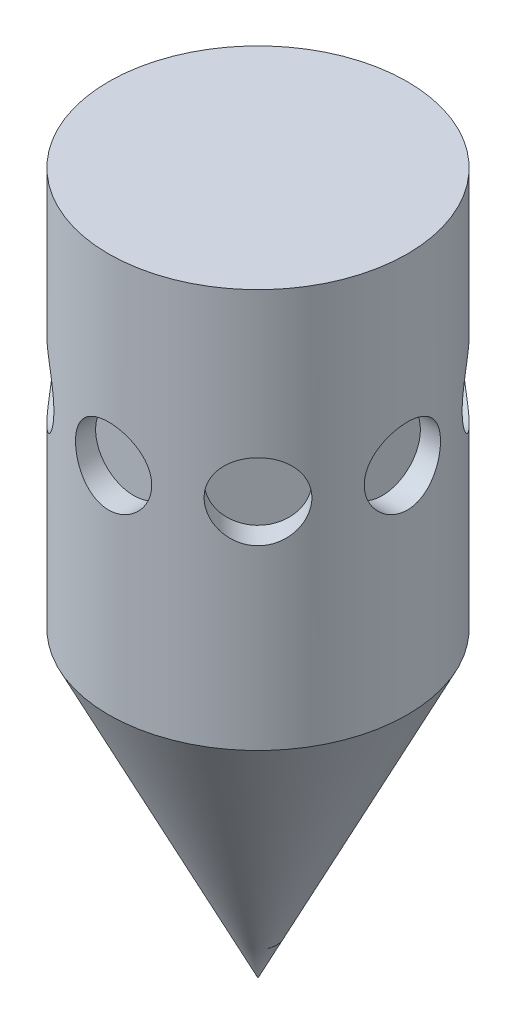
from build123d import *

# Parameters (mm, degrees)
SKETCH2_R          = 7.615394345
CUT_EXTRUDE1_DEPTH = 5
CIRPATTERN1_COUNT  = 8


with BuildPart() as part:
    # Sketch1 → Revolve1 (revolve)
    with BuildSketch(Plane.XY, mode=Mode.PRIVATE) as revolve1_sk:
        Polygon((-29.836570739, 70.106190724), (0, 70.106190724), (0, -39.684589186), (0, -70.111322573), (-15.015790503, -39.684589186), (-29.836570739, -9.65300818), align=None)
    revolve(revolve1_sk.sketch.rotate(Axis((0, 70.106190724, 0), (0, -1, 0)), 270), axis=Axis((0, 70.106190724, 0), (0, -1, 0)))

    # Sketch2 → Cut-Extrude1 (cut)
    with BuildSketch(Plane.XY.offset(29.836570739)):
        with Locations((0, 33.406581413)):
            Circle(SKETCH2_R)
    cut_extrude1 = extrude(amount=-CUT_EXTRUDE1_DEPTH, mode=Mode.SUBTRACT)

    # CirPattern1: Cut-Extrude1 ×8 about axis
    cirpattern1_axis = Axis((0, 0, 0), (0, 1, 0))
    for i in range(1, CIRPATTERN1_COUNT):
        add(cut_extrude1.rotate(cirpattern1_axis, i * 360 / CIRPATTERN1_COUNT), mode=Mode.SUBTRACT)


solid = part.part
